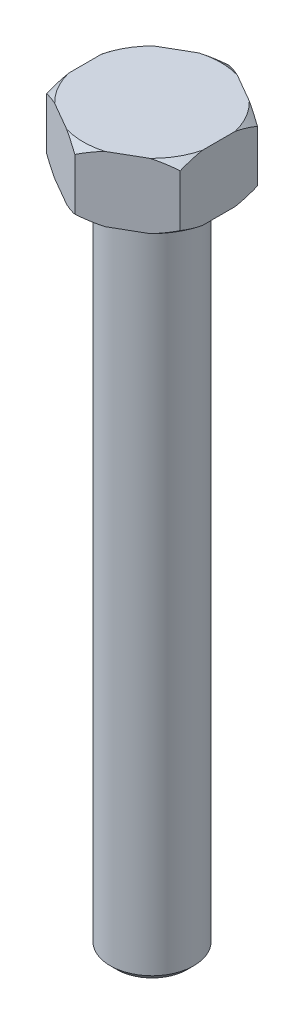
from build123d import *

# Parameters (mm, degrees)
BOSS_EXTRUDE1_DEPTH = 9.906
SKETCH3_R           = 6.35
BOSS_EXTRUDE2_DEPTH = 101.6
CHAMFER1_SIZE       = 0.9906


with BuildPart() as part:
    # Sketch1 → Boss-Extrude1 (new body)
    with BuildSketch(Plane(origin=(0, 0, 0), x_dir=(1, 0, 0), z_dir=(0, 1, 0))):
        Polygon((0, -11.73175747), (10.16, -5.865878735), (10.16, 5.865878735), (0, 11.73175747), (-10.16, 5.865878735), (-10.16, -5.865878735), align=None)
    extrude(amount=BOSS_EXTRUDE1_DEPTH)

    # Sketch3 → Boss-Extrude2 (add)
    with BuildSketch(Plane.XZ):
        with Locations(Location((0, 0, 0), (0, 0, 270))):
            Circle(SKETCH3_R)
    extrude(amount=BOSS_EXTRUDE2_DEPTH)

    # Chamfer1
    chamfer1_edges = [part.edges().sort_by_distance(p)[0] for p in [
        (0, -101.6, 6.35),
    ]]
    chamfer(chamfer1_edges, length=CHAMFER1_SIZE)

    # Sketch9 → Cut-Revolve4 (revolve, cut)
    with BuildSketch(Plane(origin=(0, 0, 0), x_dir=(0, 0, -1), z_dir=(1, 0, 0))):
        Polygon((-11.73175747, 9.906), (-10.46175747, 9.906), (-11.73175747, 8.89), align=None)
        Polygon((-11.73175747, 0), (-10.46175747, 0), (-11.73175747, 1.016), align=None)
    revolve(axis=Axis((0, 0, 0), (0, 1, 0)), mode=Mode.SUBTRACT)


solid = part.part
